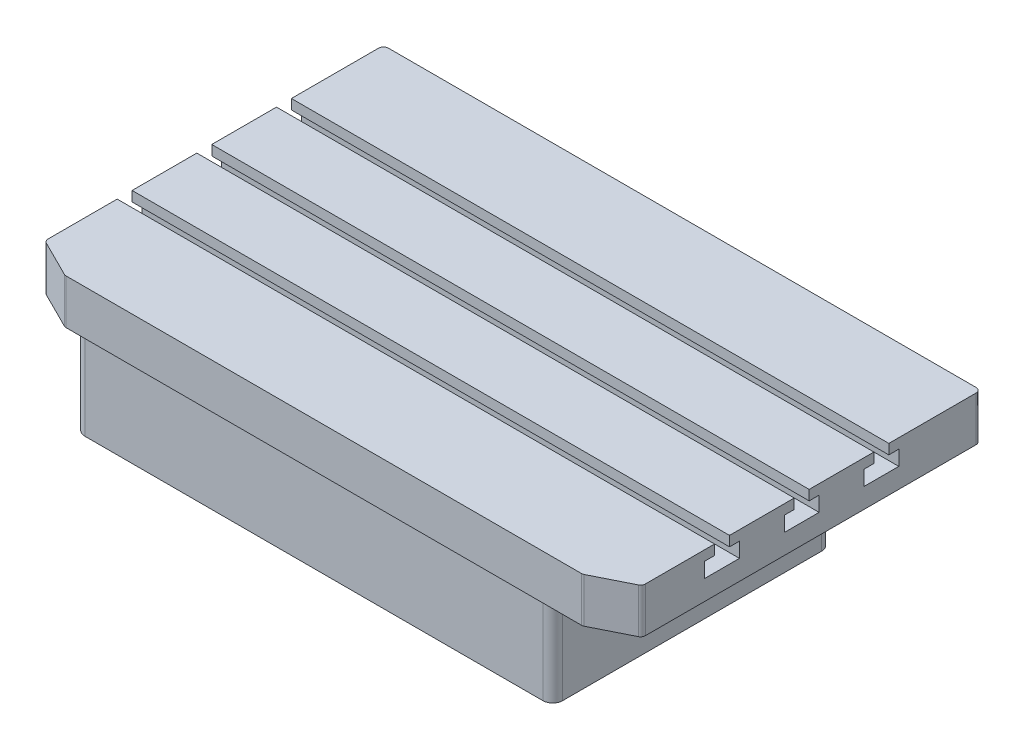
from build123d import *

# Parameters (mm, degrees)
SKETCH1_W           = 762
SKETCH1_H           = 457.2
BOSS_EXTRUDE1_DEPTH = 57.15
CUT_EXTRUDE1_DEPTH  = 448.978886221
CUT_EXTRUDE2_DEPTH  = 798.601455929
FILLET1_R           = 6.35
SKETCH4_W           = 609.6
SKETCH4_H           = 355.6
BOSS_EXTRUDE2_DEPTH = 146.05
FILLET2_R           = 12.7


with BuildPart() as part:
    # Sketch1 → Boss-Extrude1 (new body)
    with BuildSketch(Plane(origin=(0, 0, 0), x_dir=(1, 0, 0), z_dir=(0, 1, 0))):
        Rectangle(SKETCH1_W, SKETCH1_H)
    extrude(amount=BOSS_EXTRUDE1_DEPTH)

    # Sketch2 → Cut-Extrude1 (cut, through all)
    with BuildSketch(Plane(origin=(0, 57.15, 0), x_dir=(1, 0, 0), z_dir=(0, 1, 0))):
        Polygon((-381, -203.2), (-330.2, -228.6), (-381, -228.6), align=None)
        Polygon((330.2, -228.6), (381, -228.6), (381, -203.2), align=None)
    extrude(amount=-CUT_EXTRUDE1_DEPTH, mode=Mode.SUBTRACT)

    # Sketch3 → Cut-Extrude2 (cut, through all)
    with BuildSketch(Plane(origin=(381, 0, 0), x_dir=(0, 0, -1), z_dir=(1, 0, 0))):
        Polygon((-123.825, 25.4), (-79.375, 25.4), (-79.375, 44.45), (-92.075, 44.45), (-92.075, 57.15), (-111.125, 57.15), (-111.125, 44.45), (-123.825, 44.45), align=None)
        Polygon((-22.225, 25.4), (-22.225, 44.45), (-9.525, 44.45), (-9.525, 57.15), (9.525, 57.15), (9.525, 44.45), (22.225, 44.45), (22.225, 25.4), align=None)
        Polygon((79.375, 25.4), (79.375, 44.45), (92.075, 44.45), (92.075, 57.15), (111.125, 57.15), (111.125, 44.45), (123.825, 44.45), (123.825, 25.4), align=None)
    extrude(amount=-CUT_EXTRUDE2_DEPTH, mode=Mode.SUBTRACT)

    # Fillet1
    fillet1_edges = [part.edges().sort_by_distance(p)[0] for p in [
        (-381, 28.575, 203.2),
        (-330.2, 28.575, 228.6),
        (330.2, 28.575, 228.6),
        (381, 28.575, 203.2),
        (-381, 28.575, -228.6),
        (381, 28.575, -228.6),
    ]]
    fillet(fillet1_edges, radius=FILLET1_R)


with BuildPart() as body_2:
    # Sketch4 → Boss-Extrude2 (new body)
    with BuildSketch(Plane.XZ):
        with Locations((-50.8, 12.7)):
            Rectangle(SKETCH4_W, SKETCH4_H)
    extrude(amount=BOSS_EXTRUDE2_DEPTH)

    # Fillet2
    fillet2_edges = [body_2.edges().sort_by_distance(p)[0] for p in [
        (-355.6, -73.025, 190.5),
        (254, -73.025, 190.5),
        (254, -73.025, -165.1),
        (-355.6, -73.025, -165.1),
    ]]
    fillet(fillet2_edges, radius=FILLET2_R)


solid = Compound([part.part, body_2.part])
